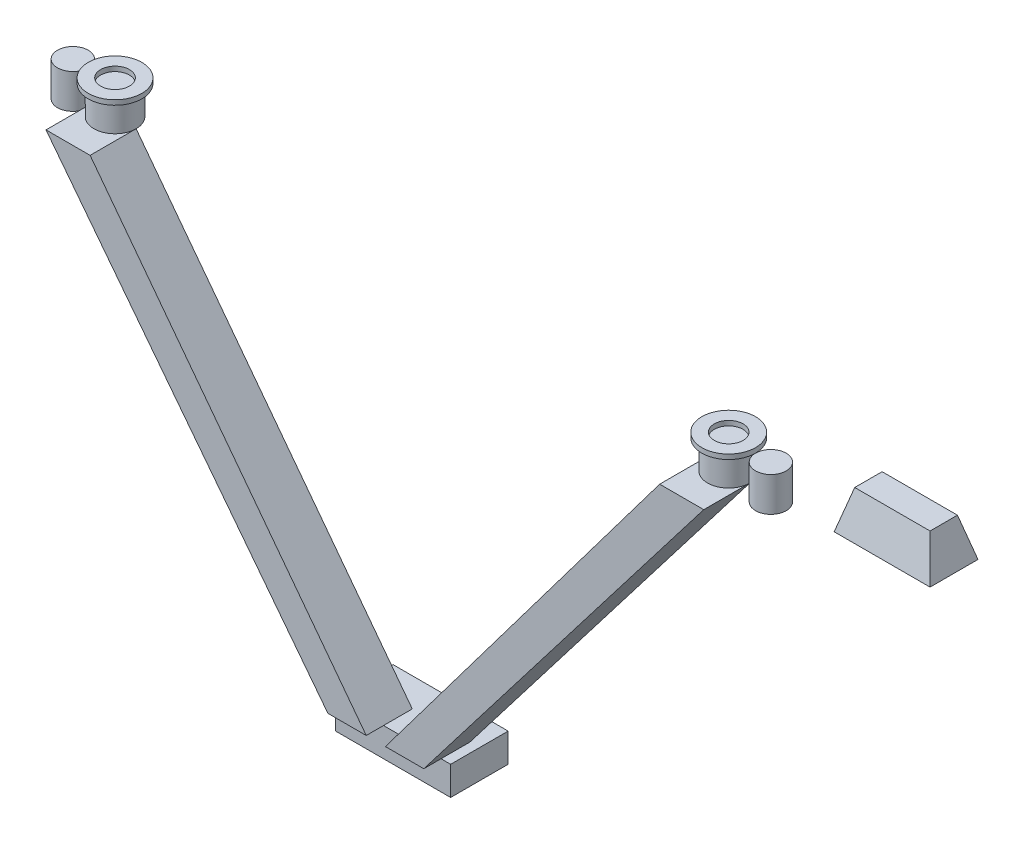
from build123d import *

# Parameters (mm, degrees)
BOSS_EXTRUDE1_START  = 3325
SKETCH1_R            = 140
SKETCH1_R_2          = 75
BOSS_EXTRUDE1_DEPTH  = 25
BOSS_EXTRUDE2_START  = 3300
SKETCH2_R            = 110
BOSS_EXTRUDE2_DEPTH  = 150
BOSS_EXTRUDE3_START  = 3120
SKETCH3_R            = 80
BOSS_EXTRUDE3_DEPTH  = 180
BOSS_EXTRUDE4_START  = 3325
SKETCH4_R            = 140
SKETCH4_R_2          = 75
BOSS_EXTRUDE4_DEPTH  = 25
BOSS_EXTRUDE5_START  = 3300
SKETCH5_R            = 110
BOSS_EXTRUDE5_DEPTH  = 150
BOSS_EXTRUDE6_START  = 3120
SKETCH6_R            = 80
BOSS_EXTRUDE6_DEPTH  = 180
BOSS_EXTRUDE7_DEPTH  = 240
BOSS_EXTRUDE8_DEPTH  = 240
BOSS_EXTRUDE9_START  = 1100
SKETCH9_W            = 600
SKETCH9_H            = 300
BOSS_EXTRUDE9_DEPTH  = 150
BOSS_EXTRUDE10_START = 750
SKETCH10_W           = 500
SKETCH10_H           = 250
BOSS_EXTRUDE10_DEPTH = 200
BOSS_EXTRUDE10_TAPER = 15


with BuildPart() as part:
    # Sketch1 → Boss-Extrude1 (new body)
    with BuildSketch(Plane(origin=(0, 0, 0), x_dir=(1, 0, 0), z_dir=(0, 1, 0)).offset(BOSS_EXTRUDE1_START)):
        with Locations(Location((-1600, 0, 0), (0, 0, 270))):
            Circle(SKETCH1_R)
        with Locations(Location((-1600, 0, 0), (0, 0, 270))):
            Circle(SKETCH1_R_2, mode=Mode.SUBTRACT)
    extrude(amount=-BOSS_EXTRUDE1_DEPTH)

    # Sketch2 → Boss-Extrude2 (add)
    with BuildSketch(Plane(origin=(0, 0, 0), x_dir=(1, 0, 0), z_dir=(0, 1, 0)).offset(BOSS_EXTRUDE2_START)):
        with Locations(Location((-1600, 0, 0), (0, 0, 270))):
            Circle(SKETCH2_R)
    extrude(amount=-BOSS_EXTRUDE2_DEPTH)

    # Sketch7 → Boss-Extrude7 (add)
    with BuildSketch(Plane.XY):
        Polygon((-1720, 3150), (-1490, 3150), (-50, 1250), (-250, 1250), align=None)
    extrude(amount=BOSS_EXTRUDE7_DEPTH)



with BuildPart() as body_2:
    # Sketch3 → Boss-Extrude3 (new body)
    with BuildSketch(Plane(origin=(0, 0, 0), x_dir=(1, 0, 0), z_dir=(0, 1, 0)).offset(BOSS_EXTRUDE3_START)):
        with Locations(Location((-1820, 0, 0), (0, 0, 90))):
            Circle(SKETCH3_R)
    extrude(amount=BOSS_EXTRUDE3_DEPTH)


with BuildPart() as body_3:
    # Sketch4 → Boss-Extrude4 (new body)
    with BuildSketch(Plane(origin=(0, 0, 0), x_dir=(1, 0, 0), z_dir=(0, 1, 0)).offset(BOSS_EXTRUDE4_START)):
        with Locations(Location((1600, 0, 0), (0, 0, 270))):
            Circle(SKETCH4_R)
        with Locations(Location((1600, 0, 0), (0, 0, 270))):
            Circle(SKETCH4_R_2, mode=Mode.SUBTRACT)
    extrude(amount=-BOSS_EXTRUDE4_DEPTH)

    # Sketch5 → Boss-Extrude5 (add)
    with BuildSketch(Plane(origin=(0, 0, 0), x_dir=(1, 0, 0), z_dir=(0, 1, 0)).offset(BOSS_EXTRUDE5_START)):
        with Locations(Location((1600, 0, 0), (0, 0, 270))):
            Circle(SKETCH5_R)
    extrude(amount=-BOSS_EXTRUDE5_DEPTH)

    # Sketch8 → Boss-Extrude8 (add)
    with BuildSketch(Plane.XY):
        Polygon((1480, 3150), (1710, 3150), (250, 1250), (50, 1250), align=None)
    extrude(amount=BOSS_EXTRUDE8_DEPTH)


with BuildPart() as body_4:
    # Sketch6 → Boss-Extrude6 (new body)
    with BuildSketch(Plane(origin=(0, 0, 0), x_dir=(1, 0, 0), z_dir=(0, 1, 0)).offset(BOSS_EXTRUDE6_START)):
        with Locations(Location((1820, 0, 0), (0, 0, 90))):
            Circle(SKETCH6_R)
    extrude(amount=BOSS_EXTRUDE6_DEPTH)


with BuildPart() as part_1:
    add(part.part)

    add(body_3.part)  # Boss-Extrude9 merges body 3
    # Sketch9 → Boss-Extrude9 (add)
    with BuildSketch(Plane(origin=(0, 0, 0), x_dir=(1, 0, 0), z_dir=(0, 1, 0)).offset(BOSS_EXTRUDE9_START)):
        Rectangle(SKETCH9_W, SKETCH9_H)
    extrude(amount=BOSS_EXTRUDE9_DEPTH)


with BuildPart() as body_4_2:
    # Sketch10 → Boss-Extrude10 (new body)
    with BuildSketch(Plane(origin=(0, 0, 0), x_dir=(1, 0, 0), z_dir=(0, 1, 0)).offset(BOSS_EXTRUDE10_START)):
        with Locations((0, 2525)):
            Rectangle(SKETCH10_W, SKETCH10_H)
    extrude(amount=BOSS_EXTRUDE10_DEPTH, taper=BOSS_EXTRUDE10_TAPER)


solid = Compound([body_2.part, body_4.part, part_1.part, body_4_2.part])
